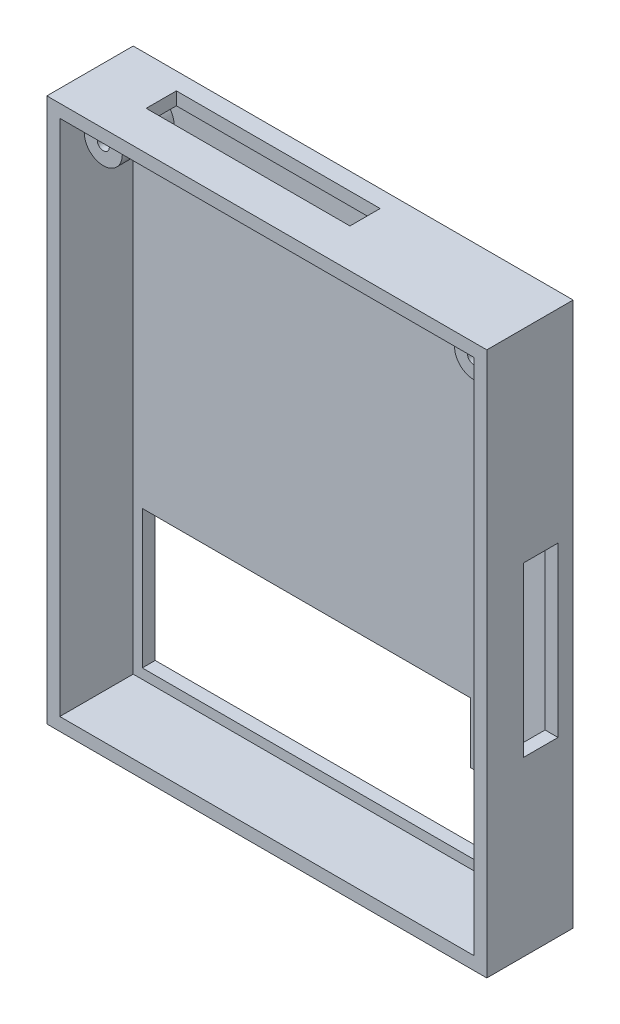
from build123d import *

# Parameters (mm, degrees)
CROQUIS1_W              = 101.9
CROQUIS1_H              = 126
SALIENTE_EXTRUIR1_DEPTH = 15
VACIADO1_T              = -3
CORTAR_EXTRUIR1_DEPTH   = 15
CROQUIS3_W              = 8
CROQUIS3_H              = 39
CORTAR_EXTRUIR2_DEPTH   = 15
CROQUIS4_W              = 47.2
CROQUIS4_H              = 7
CORTAR_EXTRUIR3_DEPTH   = 15
CROQUIS5_R              = 1.4
CORTAR_EXTRUIR4_DEPTH   = 15
SALIENTE_EXTRUIR2_START = 12
CROQUIS6_R              = 4.4
CROQUIS6_R_2            = 1.4
SALIENTE_EXTRUIR2_DEPTH = 12
CROQUIS7_W              = 101.9
CROQUIS7_H              = 126
CROQUIS7_W_2            = 95.9
CROQUIS7_H_2            = 120
SALIENTE_EXTRUIR3_DEPTH = 5


with BuildPart() as part:
    # Croquis1 → Saliente-Extruir1 (new body)
    with BuildSketch(Plane.XY):
        with Locations((50.95, 63)):
            Rectangle(CROQUIS1_W, CROQUIS1_H)
    extrude(amount=SALIENTE_EXTRUIR1_DEPTH)

    # Vaciado1
    vaciado1_openings = [part.faces().sort_by_distance(p)[0] for p in [
        (50.95, 63, 15),
    ]]
    offset(amount=VACIADO1_T, openings=vaciado1_openings, kind=Kind.INTERSECTION)

    # Croquis2 → Cortar-Extruir1 (cut)
    with BuildSketch(Plane.XY.offset(3)):
        Polygon((5.1, 37.3), (81.1, 37.3), (81.1, 23.3), (97.1, 23.3), (97.1, 5.3), (5.1, 5.3), align=None)
    extrude(amount=-CORTAR_EXTRUIR1_DEPTH, mode=Mode.SUBTRACT)

    # Croquis3 → Cortar-Extruir2 (cut)
    with BuildSketch(Plane(origin=(101.9, 0, 0), x_dir=(0, 0, -1), z_dir=(1, 0, 0))):
        with Locations((-7.5, 59.5)):
            Rectangle(CROQUIS3_W, CROQUIS3_H)
    extrude(amount=-CORTAR_EXTRUIR2_DEPTH, mode=Mode.SUBTRACT)

    # Croquis4 → Cortar-Extruir3 (cut)
    with BuildSketch(Plane(origin=(0, 126, 0), x_dir=(1, 0, 0), z_dir=(0, 1, 0))):
        with Locations((37.6, -7.5)):
            Rectangle(CROQUIS4_W, CROQUIS4_H)
    extrude(amount=-CORTAR_EXTRUIR3_DEPTH, mode=Mode.SUBTRACT)

    # Croquis5 → Cortar-Extruir4 (cut)
    with BuildSketch(Plane.XY.offset(3)):
        with Locations((8.07, 117.93)):
            Circle(CROQUIS5_R)
        with Locations((93.83, 117.93)):
            Circle(CROQUIS5_R)
    extrude(amount=-CORTAR_EXTRUIR4_DEPTH, mode=Mode.SUBTRACT)

    # Croquis6 → Saliente-Extruir2 (add)
    # profile 1 of 2: a face of its own
    with BuildSketch(Plane.XY.offset(3).offset(SALIENTE_EXTRUIR2_START)):
        with Locations(Location((93.83, 117.93, 0), (0, 0, 180))):
            Circle(CROQUIS6_R)
        with Locations((93.83, 117.93)):
            Circle(CROQUIS6_R_2, mode=Mode.SUBTRACT)
    # profile 2 of 2: a face of its own
    with BuildSketch(Plane.XY.offset(3).offset(SALIENTE_EXTRUIR2_START)):
        with Locations(Location((8.07, 117.93, 0), (0, 0, 180))):
            Circle(CROQUIS6_R)
        with Locations((8.07, 117.93)):
            Circle(CROQUIS6_R_2, mode=Mode.SUBTRACT)
    extrude(amount=-SALIENTE_EXTRUIR2_DEPTH)

    # Croquis7 → Saliente-Extruir3 (add)
    with BuildSketch(Plane.XY.offset(15)):
        with Locations((50.95, 63)):
            Rectangle(CROQUIS7_W, CROQUIS7_H)
        with Locations((50.95, 63)):
            Rectangle(CROQUIS7_W_2, CROQUIS7_H_2, mode=Mode.SUBTRACT)
    extrude(amount=SALIENTE_EXTRUIR3_DEPTH)


solid = part.part
